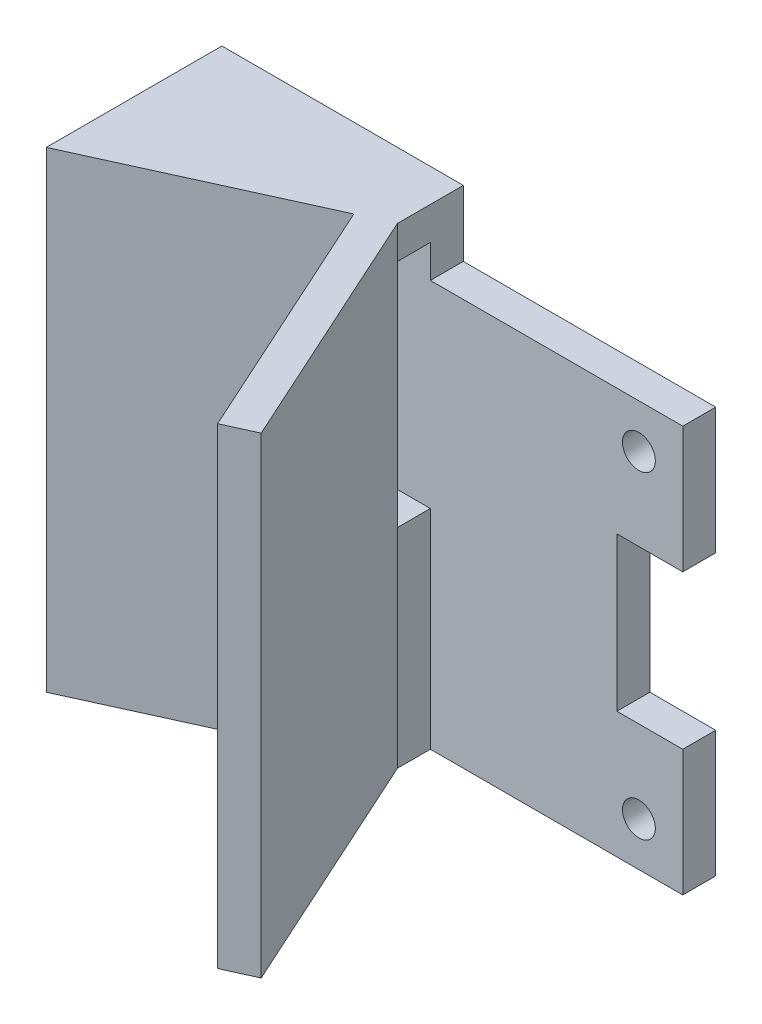
from build123d import *

# Parameters (mm, degrees)
CROQUIS1_R              = 1.5
SALIENTE_EXTRUIR1_DEPTH = 3
CROQUIS3_W              = 22
CROQUIS3_H              = 37
SALIENTE_EXTRUIR2_DEPTH = 13
CORTAR_EXTRUIR1_START   = -37
CORTAR_EXTRUIR1_DEPTH   = 37
SALIENTE_EXTRUIR4_DEPTH = 6
CROQUIS7_W              = 3.002058729
CROQUIS7_H              = 21
CORTAR_EXTRUIR2_DEPTH   = 22.000001
CROQUIS8_W              = 3
CROQUIS8_H              = 43
SALIENTE_EXTRUIR5_DEPTH = 25


with BuildPart() as part:
    # Croquis1 → Saliente-Extruir1 (new body)
    with BuildSketch(Plane.XY):
        with BuildLine():
            Line((-4.197309417, 33.461883408), (-52.197309417, 33.461883408))
            ThreePointArc((-52.197309417, 33.461883408), (-55.025736542, 32.290310533), (-56.197309417, 29.461883408))
            Line((-56.197309417, 29.461883408), (-56.197309417, 24.961883408))
            Line((-56.197309417, 24.961883408), (-49.197309417, 24.961883408))
            Line((-49.197309417, 24.961883408), (-49.197309417, 4.961883408))
            Line((-49.197309417, 4.961883408), (-56.197309417, 4.961883408))
            Line((-56.197309417, 4.961883408), (-56.197309417, 0.461883408))
            ThreePointArc((-56.197309417, 0.461883408), (-55.099110766, -2.293519818), (-52.406664651, -3.538116592))
            Line((-52.406664651, -3.538116592), (-4.197309417, -3.538116592))
            Line((-4.197309417, -3.538116592), (-4.197309417, 7.961883408))
            Line((-4.197309417, 7.961883408), (-10.197309417, 7.961883408))
            Line((-10.197309417, 7.961883408), (-10.197309417, 21.961883408))
            Line((-10.197309417, 21.961883408), (-4.197309417, 21.961883408))
            Line((-4.197309417, 21.961883408), (-4.197309417, 33.461883408))
        make_face()
        with Locations((-52.19152813, 0.461883408)):
            Circle(CROQUIS1_R, mode=Mode.SUBTRACT)
        with Locations((-8.197309417, 0.461883408)):
            Circle(CROQUIS1_R, mode=Mode.SUBTRACT)
        with Locations((-52.197309417, 29.461883408)):
            Circle(CROQUIS1_R, mode=Mode.SUBTRACT)
        with Locations((-8.197309417, 29.461883408)):
            Circle(CROQUIS1_R, mode=Mode.SUBTRACT)
    extrude(amount=SALIENTE_EXTRUIR1_DEPTH)

    # Croquis3 → Saliente-Extruir2 (add)
    with BuildSketch(Plane.XY.offset(3)):
        with Locations((-38.197309417, 14.961883408)):
            Rectangle(CROQUIS3_W, CROQUIS3_H)
    extrude(amount=SALIENTE_EXTRUIR2_DEPTH)

    # Croquis4 → Cortar-Extruir1 (cut)
    with BuildSketch(Plane.XZ.offset(3.538116592).offset(CORTAR_EXTRUIR1_START)):
        Polygon((-27.197309417, 16), (-27.197309417, 6.002058729), (-49.197309417, 16), align=None)
    extrude(amount=CORTAR_EXTRUIR1_DEPTH, mode=Mode.SUBTRACT)

    # Croquis6 → Saliente-Extruir4 (add)
    with BuildSketch(Plane(origin=(0, 33.461883408, 0), x_dir=(1, 0, 0), z_dir=(0, 1, 0))):
        Polygon((-27.197309417, -6.002058729), (-49.197309417, -16), (-49.197309417, 0), (-27.197309417, 0), align=None)
    extrude(amount=SALIENTE_EXTRUIR4_DEPTH)

    # Croquis7 → Cortar-Extruir2 (cut)
    with BuildSketch(Plane(origin=(-27.197309417, 0, 0), x_dir=(0, 0, -1), z_dir=(1, 0, 0))):
        with Locations((-4.501029365, 25.961883408)):
            Rectangle(CROQUIS7_W, CROQUIS7_H)
    extrude(amount=-CORTAR_EXTRUIR2_DEPTH, mode=Mode.SUBTRACT)

    # Croquis8 → Saliente-Extruir5 (add)
    with BuildSketch(Plane(origin=(-2.394740987, 0, -5.269515022), x_dir=(0.9103985682863143, 0, -0.4137323372208525), z_dir=(0.4137323372208525, 0, 0.9103985682863143))):
        with Locations((-28.743637341, 17.961883408)):
            Rectangle(CROQUIS8_W, CROQUIS8_H)
    extrude(amount=SALIENTE_EXTRUIR5_DEPTH)


solid = part.part
